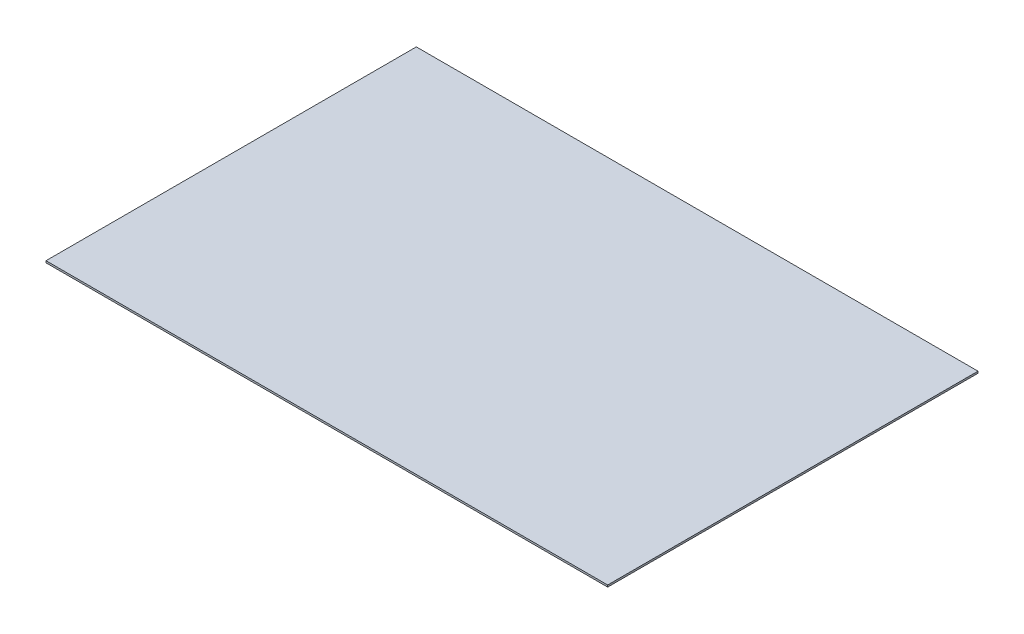
from build123d import *

# Parameters (mm, degrees)
SKETCH1_W           = 910
SKETCH1_H           = 600
BOSS_EXTRUDE1_DEPTH = 3


with BuildPart() as part:
    # Sketch1 → Boss-Extrude1 (new body)
    with BuildSketch(Plane(origin=(0, 0, 0), x_dir=(1, 0, 0), z_dir=(0, 1, 0))):
        with Locations((251.052303861, 47.347447073)):
            Rectangle(SKETCH1_W, SKETCH1_H)
    extrude(amount=BOSS_EXTRUDE1_DEPTH)


solid = part.part
